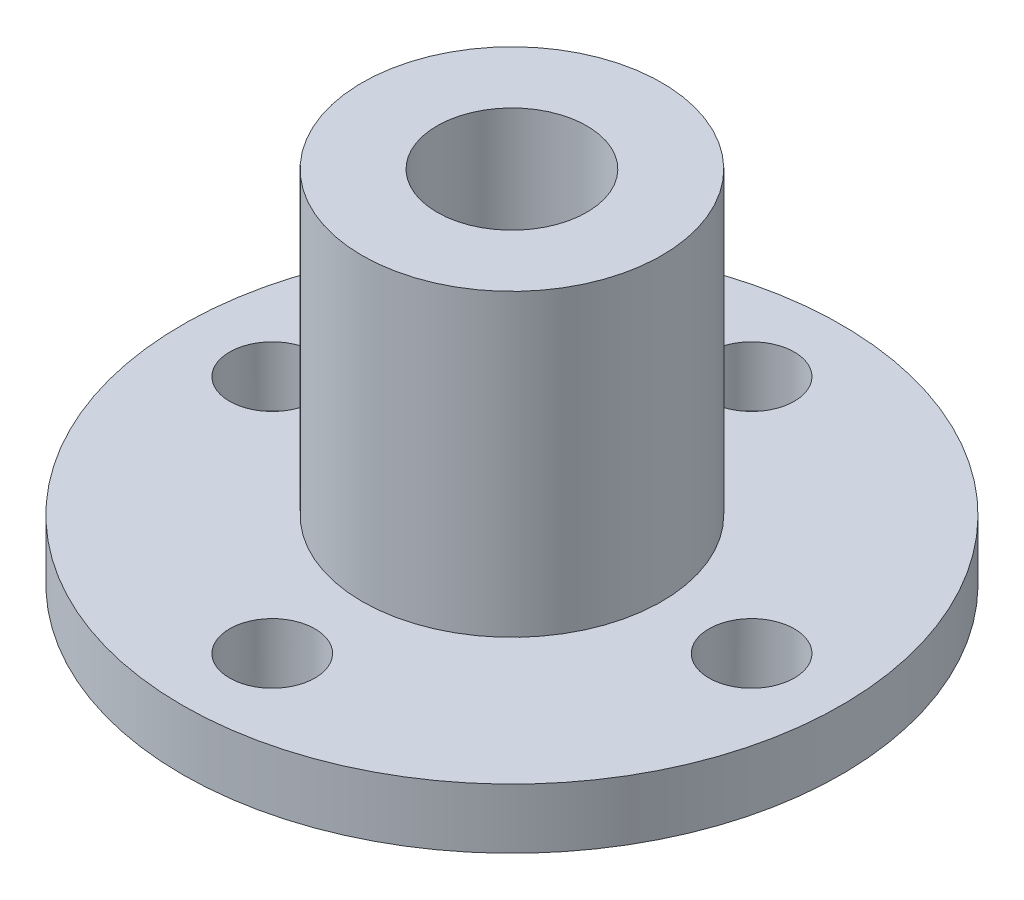
from build123d import *

# Parameters (mm, degrees)
SKETCH1_R           = 11
SKETCH1_R_2         = 2.5
BOSS_EXTRUDE1_DEPTH = 2
SKETCH1_3_R         = 5
SKETCH1_3_R_2       = 2.5
BOSS_EXTRUDE2_DEPTH = 12
SKETCH2_R           = 1.425
CUT_EXTRUDE1_DEPTH  = 19.493242009
CIRPATTERN1_COUNT   = 4


with BuildPart() as part:
    # Sketch1 → Boss-Extrude1 (new body)
    with BuildSketch(Plane(origin=(0, 0, 0), x_dir=(1, 0, 0), z_dir=(0, 1, 0))):
        Circle(SKETCH1_R)
        Circle(SKETCH1_R_2, mode=Mode.SUBTRACT)
    extrude(amount=BOSS_EXTRUDE1_DEPTH)

    # Sketch1<3> → Boss-Extrude2 (add)
    with BuildSketch(Plane(origin=(0, 0, 0), x_dir=(1, 0, 0), z_dir=(0, 1, 0))):
        Circle(SKETCH1_3_R)
        Circle(SKETCH1_3_R_2, mode=Mode.SUBTRACT)
    extrude(amount=BOSS_EXTRUDE2_DEPTH)

    # Sketch2 → Cut-Extrude1 (cut, symmetric)
    with BuildSketch(Plane(origin=(0, 2, 0), x_dir=(1, 0, 0), z_dir=(0, 1, 0))):
        with Locations((0, 8)):
            Circle(SKETCH2_R)
    cut_extrude1 = extrude(amount=CUT_EXTRUDE1_DEPTH, both=True, mode=Mode.SUBTRACT)

    # CirPattern1: Cut-Extrude1 ×4 about axis
    cirpattern1_axis = Axis((0, 12, 0), (0, -1, 0))
    for i in range(1, CIRPATTERN1_COUNT):
        add(cut_extrude1.rotate(cirpattern1_axis, i * 360 / CIRPATTERN1_COUNT), mode=Mode.SUBTRACT)


solid = part.part
